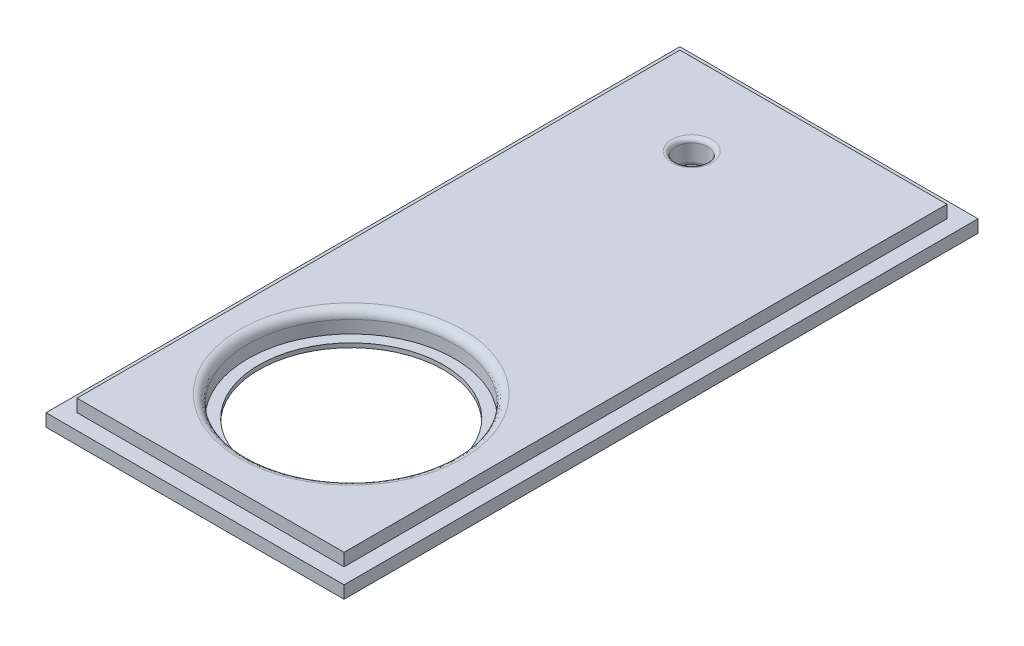
from build123d import *

# Parameters (mm, degrees)
SKETCH1_W           = 35.5
SKETCH1_H           = 75.5
BOSS_EXTRUDE1_DEPTH = 1.5
BOSS_EXTRUDE2_DEPTH = 1.5
SKETCH2_R           = 11
CUT_EXTRUDE1_DEPTH  = 10
CUT_EXTRUDE2_DEPTH  = 2.5
SKETCH4_R           = 1.9
CUT_EXTRUDE3_DEPTH  = 6
FILLET1_R           = 0.5
FILLET2_R           = 0.5
FILLET3_R           = 1


with BuildPart() as part:
    # Sketch1 → Boss-Extrude1 (new body)
    with BuildSketch(Plane(origin=(0, 0, 0), x_dir=(1, 0, 0), z_dir=(0, 1, 0))):
        with Locations((17.75, 37.75)):
            Rectangle(SKETCH1_W, SKETCH1_H)
    extrude(amount=BOSS_EXTRUDE1_DEPTH)

    # 3DSketch1 → Boss-Extrude2 (add)
    with BuildSketch(Plane(origin=(1.85, 1.5, -1.85), x_dir=(0.40495657653791334, 0, -0.9143359180950364), z_dir=(0, 1, 0))):
        Polygon((0, 0), (12.877619134, -29.075882195), (78.526938053, 0), (65.649318919, 29.075882195), align=None)
    extrude(amount=BOSS_EXTRUDE2_DEPTH)

    # Sketch2 → Cut-Extrude1 (cut)
    with BuildSketch(Plane(origin=(0, 3, 0), x_dir=(1, 0, 0), z_dir=(0, 1, 0))):
        with Locations(Location((17.75, 18.6, 0), (0, 0, 270))):
            Circle(SKETCH2_R)
    extrude(amount=-CUT_EXTRUDE1_DEPTH, mode=Mode.SUBTRACT)

    # 3DSketch2 → Cut-Extrude2 (cut)
    with BuildSketch(Plane(origin=(17.75, 3, -6.3), x_dir=(-0.004227803372085647, 0, -0.9999910627993868), z_dir=(0, -1, 0))):
        with BuildLine():
            add(Edge.make_bspline(
                [(0, 0), (0.004386995, -1.04174525), (0.27944755, -3.123987084), (1.476453938, -6.075565296), (3.410311469, -8.653144172), (5.973707785, -10.661776555), (8.970625928, -11.936313966), (12.195586401, -12.389659387), (15.427695721, -11.99044335), (18.445556685, -10.766344357), (21.042285232, -8.800917271), (23.040178447, -6.229084123), (24.302092158, -3.226838845), (24.741880785, 0), (24.329080551, 3.230402285), (23.092306587, 6.243090971), (21.115981025, 8.831534564), (18.535772158, 10.818599013), (15.528248734, 12.067881173), (12.299589709, 12.494101301), (9.070951129, 12.06772549), (6.063488405, 10.818297059), (3.483374022, 8.831111933), (1.507182222, 6.242560327), (0.270527087, 3.229871892), (-0.004531746, 1.07611808), (0, 0)],
                knots=[0, 0, 0, 0, 0.04044329, 0.080893626, 0.122671197, 0.164448751, 0.206226312, 0.248003874, 0.289781435, 0.331558997, 0.373336558, 0.415114119, 0.456891681, 0.498669242, 0.540446803, 0.582224365, 0.624001926, 0.665779488, 0.707557049, 0.74933461, 0.791112172, 0.832889733, 0.874667296, 0.916444855, 0.958222266, 1, 1, 1, 1], degree=3))
        make_face()
    extrude(amount=CUT_EXTRUDE2_DEPTH, mode=Mode.SUBTRACT)

    # Sketch4 → Cut-Extrude3 (cut)
    with BuildSketch(Plane(origin=(0, 3, 0), x_dir=(1, 0, 0), z_dir=(0, 1, 0))):
        with Locations(Location((12.975, 63.925, 0), (0, 0, 270))):
            Circle(SKETCH4_R)
    extrude(amount=-CUT_EXTRUDE3_DEPTH, mode=Mode.SUBTRACT)

    # Fillet1
    fillet1_edges = [part.edges().sort_by_distance(p)[0] for p in [
        (12.975, 3, -65.825),
    ]]
    fillet(fillet1_edges, radius=FILLET1_R)

    # Fillet2
    fillet2_edges = [part.edges().sort_by_distance(p)[0] for p in [
        (12.975, 0, -65.825),
    ]]
    fillet(fillet2_edges, radius=FILLET2_R)

    # Fillet3
    fillet3_edges = [part.edges().sort_by_distance(p)[0] for p in [
        (17.749997791, 3, -30.899997542),
    ]]
    fillet(fillet3_edges, radius=FILLET3_R)


solid = part.part
